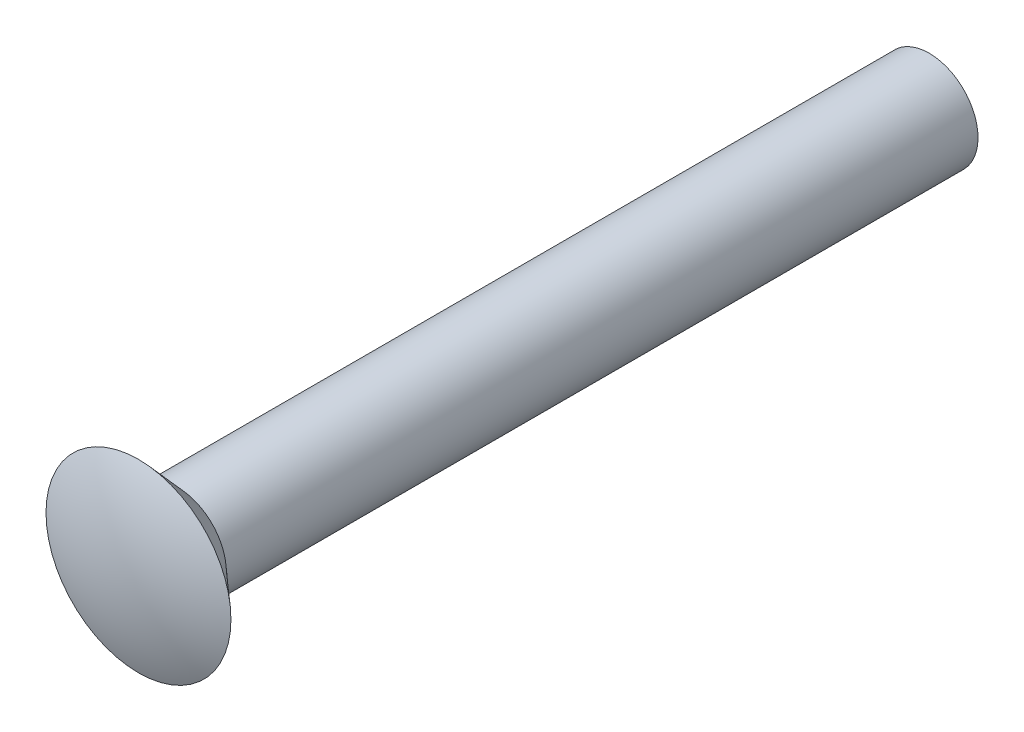
from build123d import *


with BuildPart() as part:
    # Эскиз1 → Повернуть1 (revolve)
    with BuildSketch(Plane(origin=(0, 0, 0), x_dir=(0, 0, -1), z_dir=(1, 0, 0))):
        with BuildLine():
            Line((5.454356057, 5), (82.454356057, 5))
            Line((82.454356057, 5), (83.454356057, 3))
            Line((83.454356057, 3), (83.454356057, 0))
            Line((83.454356057, 0), (-0.545643943, 0))
            ThreePointArc((-0.545643943, 0), (-0.040192002, 4.840489633), (1.454356057, 9.472135955))
            Line((1.454356057, 9.472135955), (5.454356057, 5))
        make_face()
    revolve(axis=Axis((0, 0, -83.454356057), (0, 0, 1)))


solid = part.part
